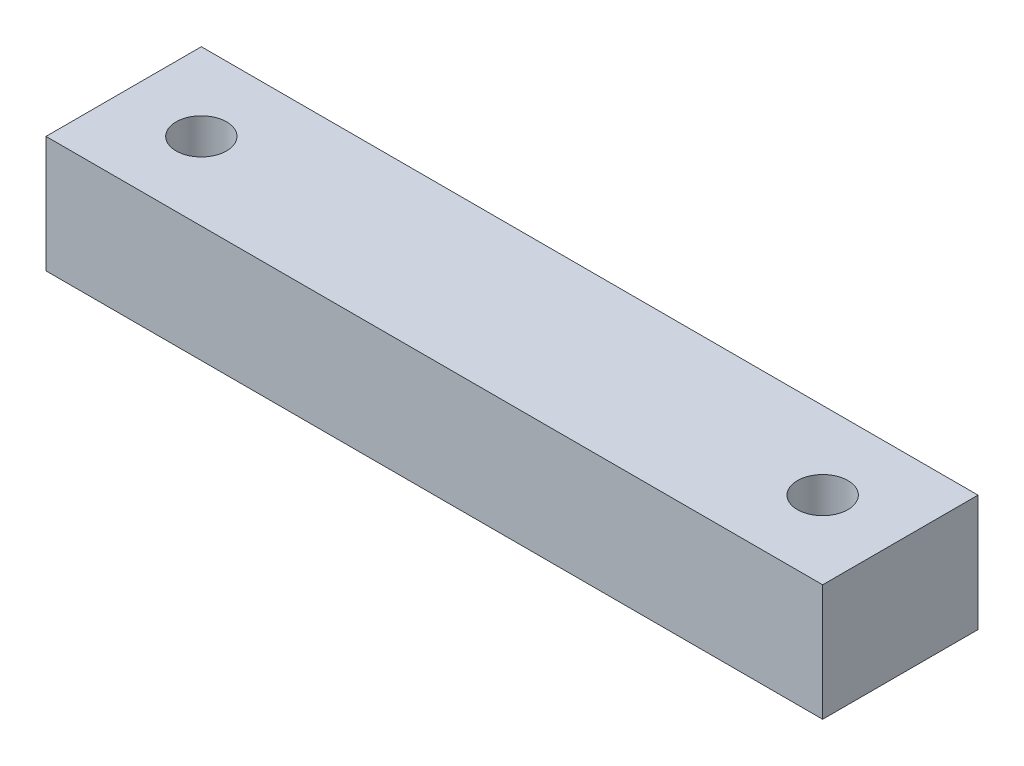
from build123d import *

# Parameters (mm, degrees)
SKETCH1_W           = 100
SKETCH1_H           = 20
BOSS_EXTRUDE1_DEPTH = 15
SKETCH2_R           = 7.5
CUT_EXTRUDE1_DEPTH  = 6
SKETCH3_R           = 3.25
CUT_EXTRUDE2_DEPTH  = 103.376755174


with BuildPart() as part:
    # Sketch1 → Boss-Extrude1 (new body)
    with BuildSketch(Plane(origin=(0, 0, 0), x_dir=(1, 0, 0), z_dir=(0, 1, 0))):
        with Locations((50, 10)):
            Rectangle(SKETCH1_W, SKETCH1_H)
    extrude(amount=BOSS_EXTRUDE1_DEPTH)

    # Sketch2 → Cut-Extrude1 (cut)
    with BuildSketch(Plane.XZ):
        with Locations(Location((10, -10, 0), (0, 0, 270))):
            Circle(SKETCH2_R)
        with Locations(Location((90, -10, 0), (0, 0, 270))):
            Circle(SKETCH2_R)
    extrude(amount=-CUT_EXTRUDE1_DEPTH, mode=Mode.SUBTRACT)

    # Sketch3 → Cut-Extrude2 (cut, through all)
    with BuildSketch(Plane.XZ.offset(-6)):
        with Locations(Location((10, -10, 0), (0, 0, 270))):
            Circle(SKETCH3_R)
        with Locations(Location((90, -10, 0), (0, 0, 270))):
            Circle(SKETCH3_R)
    extrude(amount=-CUT_EXTRUDE2_DEPTH, mode=Mode.SUBTRACT)


solid = part.part
